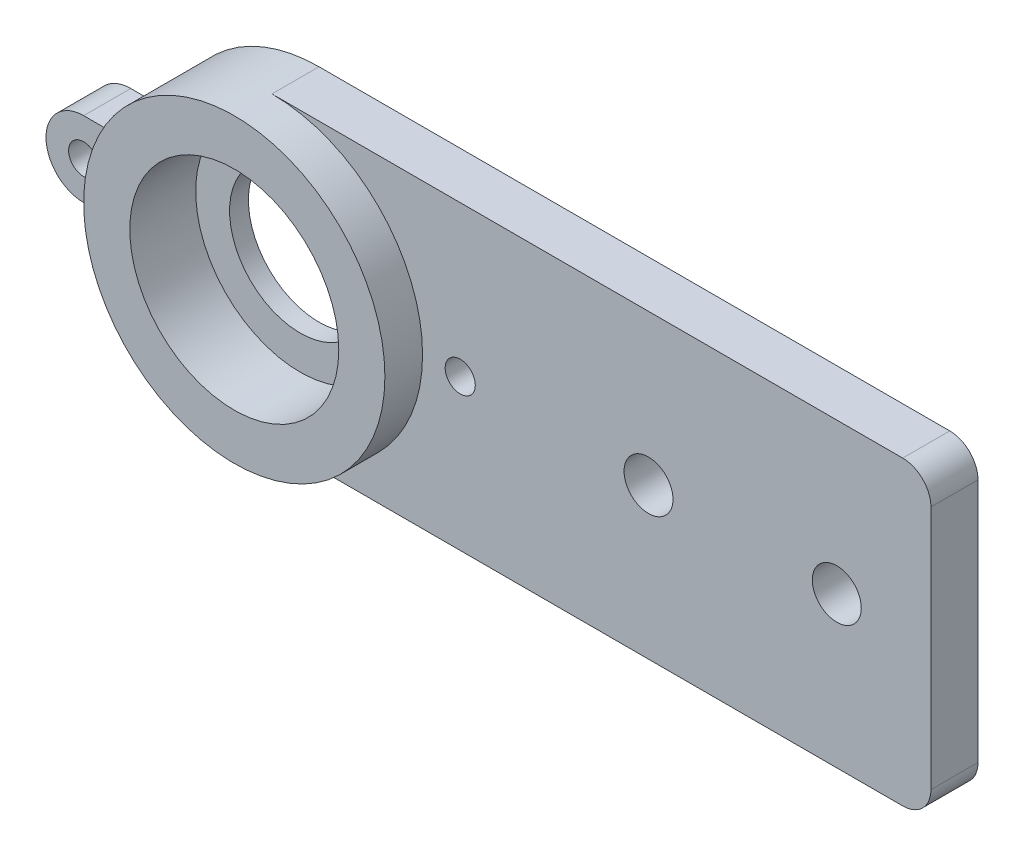
from build123d import *

# Parameters (mm, degrees)
SKETCH3_R           = 7.5
BOSS_EXTRUDE3_DEPTH = 2
SKETCH2_R           = 16
SKETCH2_R_2         = 11.1
BOSS_EXTRUDE4_DEPTH = 9
SKETCH4_R           = 2.6
BOSS_EXTRUDE5_DEPTH = 5
FILLET3_R           = 3
SKETCH5_R           = 1.6
BOSS_EXTRUDE6_DEPTH = 5
SKETCH6_R           = 1.6
CUT_EXTRUDE1_DEPTH  = 10


with BuildPart() as part:
    # Sketch3 → Boss-Extrude3 (new body)
    with BuildSketch(Plane.XY):
        with BuildLine():
            Line((-15.491933385, 4), (-15.491933385, -4))
            ThreePointArc((-15.491933385, -4), (16, 0), (-15.491933385, 4))
        make_face()
        Circle(SKETCH3_R, mode=Mode.SUBTRACT)
    extrude(amount=BOSS_EXTRUDE3_DEPTH)

    # Sketch2 → Boss-Extrude4 (add)
    with BuildSketch(Plane.XY):
        Circle(SKETCH2_R)
        Circle(SKETCH2_R_2, mode=Mode.SUBTRACT)
    extrude(amount=BOSS_EXTRUDE4_DEPTH)

    # Sketch4 → Boss-Extrude5 (add)
    with BuildSketch(Plane.XY):
        with BuildLine():
            Line((70, 16), (30, 16))
            Line((30, 16), (0, 16))
            ThreePointArc((0, 16), (11.313708499, 11.313708499), (16, 0))
            ThreePointArc((16, 0), (11.313708499, -11.313708499), (0, -16))
            Line((0, -16), (70, -16))
            Line((70, -16), (70, 16))
        make_face()
        with Locations((40, 0)):
            Circle(SKETCH4_R, mode=Mode.SUBTRACT)
        with Locations((60, 0)):
            Circle(SKETCH4_R, mode=Mode.SUBTRACT)
    extrude(amount=BOSS_EXTRUDE5_DEPTH)

    # Fillet3
    fillet3_edges = [part.edges().sort_by_distance(p)[0] for p in [
        (70, -16, 2.5),
        (70, 16, 2.5),
    ]]
    fillet(fillet3_edges, radius=FILLET3_R)

    # Sketch5 → Boss-Extrude6 (add)
    with BuildSketch(Plane.XY):
        with BuildLine():
            Line((-20, 4), (-15.491933385, 4))
            Line((-15.491933385, 4), (-15.491933385, -4))
            Line((-15.491933385, -4), (-20, -4))
            ThreePointArc((-20, -4), (-24, 0), (-20, 4))
        make_face()
        with Locations((-20, 0)):
            Circle(SKETCH5_R, mode=Mode.SUBTRACT)
    extrude(amount=BOSS_EXTRUDE6_DEPTH)

    # Sketch6 → Cut-Extrude1 (cut)
    with BuildSketch(Plane.XY.offset(5)):
        with Locations((20, 0)):
            Circle(SKETCH6_R)
    extrude(amount=-CUT_EXTRUDE1_DEPTH, mode=Mode.SUBTRACT)


solid = part.part
